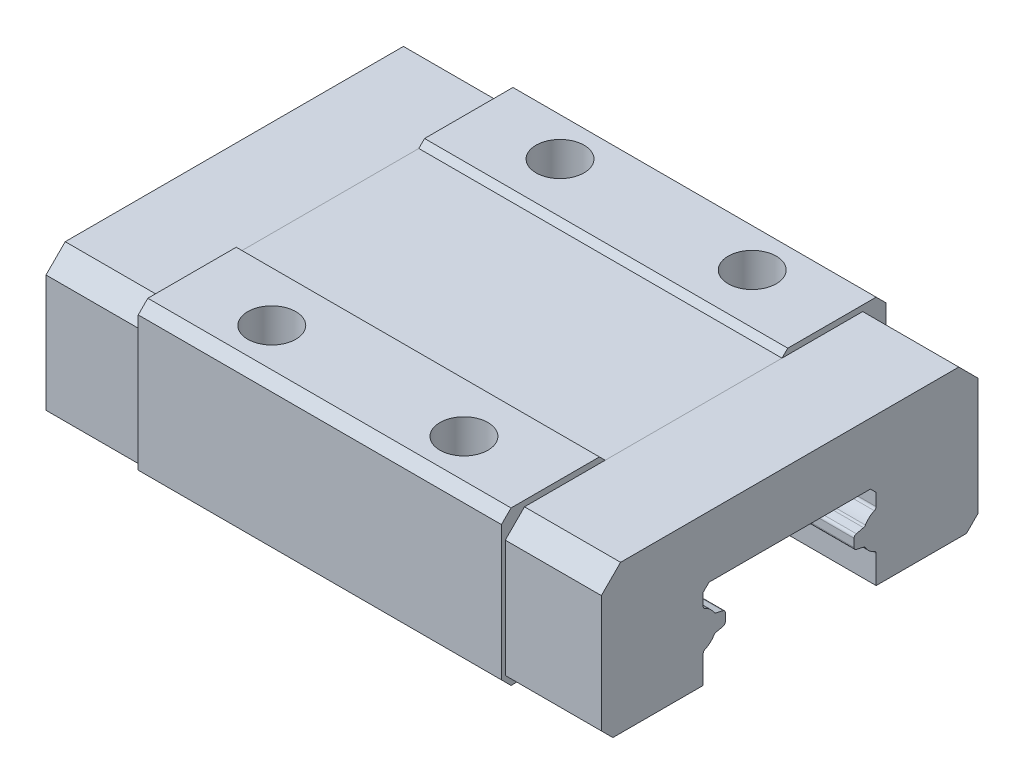
from build123d import *

# Parameters (mm, degrees)
EXTRUDE_1_DEPTH          = 9.45
EXTRUDE_1_DEPTH_BACK     = 9.45
EXTRUDE_2_DEPTH          = 14.45
EXTRUDE_2_DEPTH_BACK     = 14.45
CUT_EXTRUDE_1_DEPTH      = 24.45
CUT_EXTRUDE_1_DEPTH_BACK = 26.45
HOLE_WIZARD_M3_1_D       = 2.5
HOLE_WIZARD_M3_1_DEPTH   = 6.5
HOLE_WIZARD_M3_1_TIP     = 0.751075774


with BuildPart() as part:
    # 草图1 → 凸台-拉伸1 (new, two sides: drawn at the far end of the back side and taken through both)
    with BuildSketch(Plane(origin=(0, 0, 0), x_dir=(0, 0, -1), z_dir=(1, 0, 0)).offset(-EXTRUDE_1_DEPTH_BACK)):
        Polygon((-10, 7.500004795), (-10, 0.499995205), (-9.500004795, 0), (9.500004795, 0), (10, 0.499995205), (10, 7.500004795), (9.500004795, 8), (4.9, 8), (4.6, 7.7), (-4.6, 7.7), (-4.9, 8), (-9.500004795, 8), align=None)
    extrude(amount=EXTRUDE_1_DEPTH + EXTRUDE_1_DEPTH_BACK)

    # 草图2 → 凸台-拉伸2 (add, two sides: drawn at the far end of the back side and taken through both)
    with BuildSketch(Plane(origin=(0, 0, 0), x_dir=(0, 0, -1), z_dir=(1, 0, 0)).offset(-EXTRUDE_2_DEPTH_BACK)):
        Polygon((-9.8, 6.70000959), (-9.8, 0.599980104), (-9.200019896, 0), (9.200019896, 0), (9.8, 0.599980104), (9.8, 6.70000959), (8.80000959, 7.7), (-8.80000959, 7.7), align=None)
    extrude(amount=EXTRUDE_2_DEPTH + EXTRUDE_2_DEPTH_BACK)

    # 草图3 → 切除-拉伸1 (cut, two sides: drawn at the far end of the back side and taken through both)
    with BuildSketch(Plane(origin=(0, 0, 0), x_dir=(0, 0, -1), z_dir=(1, 0, 0)).offset(-CUT_EXTRUDE_1_DEPTH_BACK)):
        with BuildLine():
            Line((-4.5, 4.199974593), (-4.5, 3.5583))
            ThreePointArc((-4.5, 3.5583), (-4.475010695, 3.475400506), (-4.408368985, 3.420122355))
            ThreePointArc((-4.408368985, 3.420122355), (-4.141124334, 3.252255308), (-3.93950231, 3.009464023))
            ThreePointArc((-3.93950231, 3.009464023), (-3.898814145, 2.964704671), (-3.843755349, 2.939655613))
            Line((-3.843755349, 2.939655613), (-3.466644651, 2.853644387))
            ThreePointArc((-3.466644651, 2.853644387), (-3.382732565, 2.800932608), (-3.35, 2.7074))
            Line((-3.35, 2.7074), (-3.35, 2.2926))
            ThreePointArc((-3.35, 2.2926), (-3.382732565, 2.199067392), (-3.466644651, 2.146355613))
            Line((-3.466644651, 2.146355613), (-3.843755349, 2.060344387))
            ThreePointArc((-3.843755349, 2.060344387), (-3.898814145, 2.035295329), (-3.93950231, 1.990535977))
            ThreePointArc((-3.93950231, 1.990535977), (-4.141123452, 1.74774336), (-4.408368985, 1.579877645))
            ThreePointArc((-4.408368985, 1.579877645), (-4.475010695, 1.524599494), (-4.5, 1.4417))
            Line((-4.5, 1.4417), (-4.5, -1.500004795))
            Line((-4.5, -1.500004795), (-4.000004795, -2))
            Line((-4.000004795, -2), (1.4, -2))
            ThreePointArc((1.4, -2), (1.8, -1.8), (2.2, -2))
            Line((2.2, -2), (4.000004795, -2))
            Line((4.000004795, -2), (4.5, -1.500004795))
            Line((4.5, -1.500004795), (4.5, 1.4417))
            ThreePointArc((4.5, 1.4417), (4.475010695, 1.524599494), (4.408368985, 1.579877645))
            ThreePointArc((4.408368985, 1.579877645), (4.141124334, 1.747744692), (3.93950231, 1.990535977))
            ThreePointArc((3.93950231, 1.990535977), (3.898814145, 2.035295329), (3.843755349, 2.060344387))
            Line((3.843755349, 2.060344387), (3.466644651, 2.146355613))
            ThreePointArc((3.466644651, 2.146355613), (3.382732565, 2.199067392), (3.35, 2.2926))
            Line((3.35, 2.2926), (3.35, 2.7074))
            ThreePointArc((3.35, 2.7074), (3.382732565, 2.800932608), (3.466644651, 2.853644387))
            Line((3.466644651, 2.853644387), (3.843755349, 2.939655613))
            ThreePointArc((3.843755349, 2.939655613), (3.898814145, 2.964704671), (3.93950231, 3.009464023))
            ThreePointArc((3.93950231, 3.009464023), (4.141123452, 3.25225664), (4.408368985, 3.420122355))
            ThreePointArc((4.408368985, 3.420122355), (4.475010695, 3.475400506), (4.5, 3.5583))
            Line((4.5, 3.5583), (4.5, 4.199974593))
            Line((4.5, 4.199974593), (4.199974593, 4.5))
            Line((4.199974593, 4.5), (-4.199974593, 4.5))
            Line((-4.199974593, 4.5), (-4.5, 4.199974593))
        make_face()
    extrude(amount=CUT_EXTRUDE_1_DEPTH + CUT_EXTRUDE_1_DEPTH_BACK, mode=Mode.SUBTRACT)

    # 草图12 → 切除-旋转6 (revolve, cut)
    with BuildSketch(Plane.XY.offset(5)):
        Polygon((-13.45, 6.2), (-13.45, 7), (-13.2605, 6.8105), (-9.45, 6.8105), (-9.097527661, 6.2), align=None)
    revolve(axis=Axis((-9.097527661, 6.2, 5), (-1, 0, 0)), mode=Mode.SUBTRACT)

    # M3 螺纹孔1
    with Locations(Plane(origin=(0, 8, 0), x_dir=(1, 0, 0), z_dir=(0, 1, 0))):
        with Locations((5, -7.5), (-5, -7.5), (5, 7.5), (-5, 7.5)):
            Hole(HOLE_WIZARD_M3_1_D / 2, depth=HOLE_WIZARD_M3_1_DEPTH)
            with Locations((0, 0, -(HOLE_WIZARD_M3_1_DEPTH + HOLE_WIZARD_M3_1_TIP / 2))):  # 118° drill point
                Cone(0, HOLE_WIZARD_M3_1_D / 2, HOLE_WIZARD_M3_1_TIP, mode=Mode.SUBTRACT)


solid = part.part
